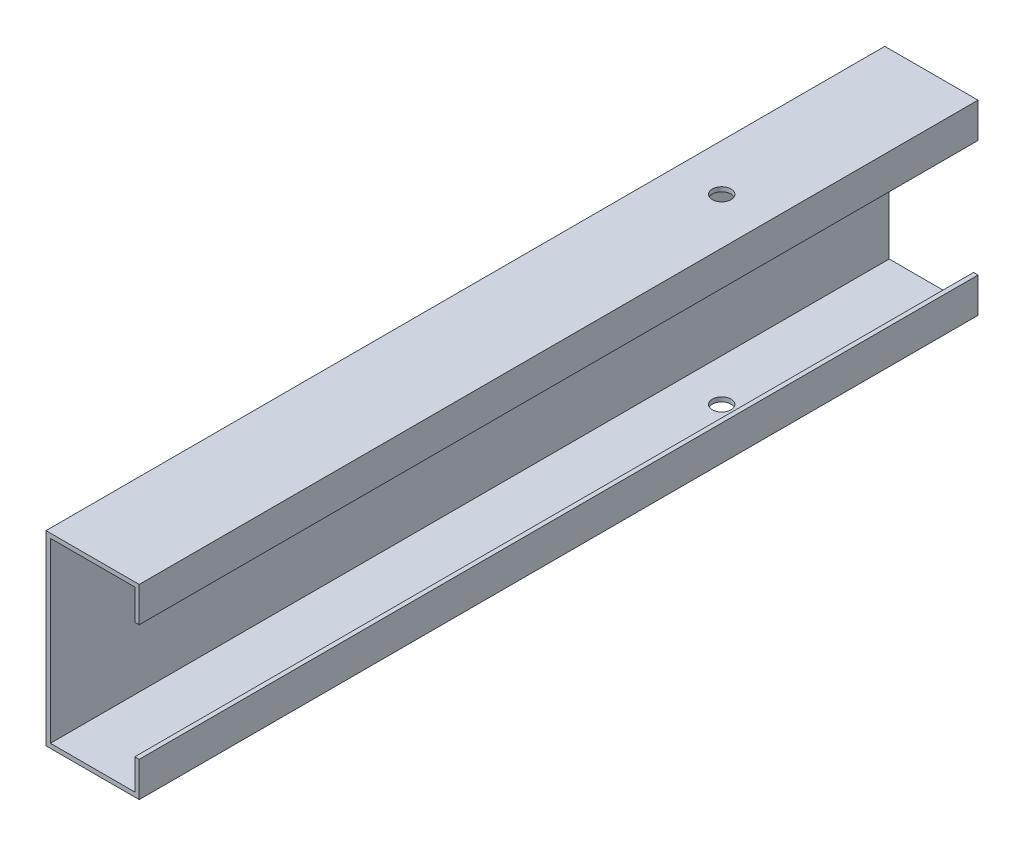
from build123d import *

# Parameters (mm, degrees)
SALIENTE_EXTRUIR1_DEPTH = 360
CROQUIS2_R              = 4
CORTAR_EXTRUIR1_DEPTH   = 365.417343166
CROQUIS3_R              = 4
CORTAR_EXTRUIR2_DEPTH   = 370.323706252


with BuildPart() as part:
    # Croquis1 → Saliente-Extruir1 (new body)
    with BuildSketch(Plane.XY):
        Polygon((18.1, -38.1), (18.1, -25), (20, -25), (20, -38.1), (20, -40), (-20, -40), (-20, 40), (20, 40), (20, 25), (18.1, 25), (18.1, 38.1), (-18.1, 38.1), (-18.1, -38.1), align=None)
    extrude(amount=SALIENTE_EXTRUIR1_DEPTH)

    # Croquis2 → Cortar-Extruir1 (cut, through all)
    with BuildSketch(Plane.ZY.offset(20)):
        with Locations((270, 0)):
            Circle(CROQUIS2_R)
        with Locations((90, 0)):
            Circle(CROQUIS2_R)
    extrude(amount=-CORTAR_EXTRUIR1_DEPTH, mode=Mode.SUBTRACT)

    # Croquis3 → Cortar-Extruir2 (cut, through all)
    with BuildSketch(Plane(origin=(0, 40, 0), x_dir=(1, 0, 0), z_dir=(0, 1, 0))):
        with Locations(Location((0, -90, 0), (0, 0, 270))):
            Circle(CROQUIS3_R)
    extrude(amount=-CORTAR_EXTRUIR2_DEPTH, mode=Mode.SUBTRACT)


solid = part.part
